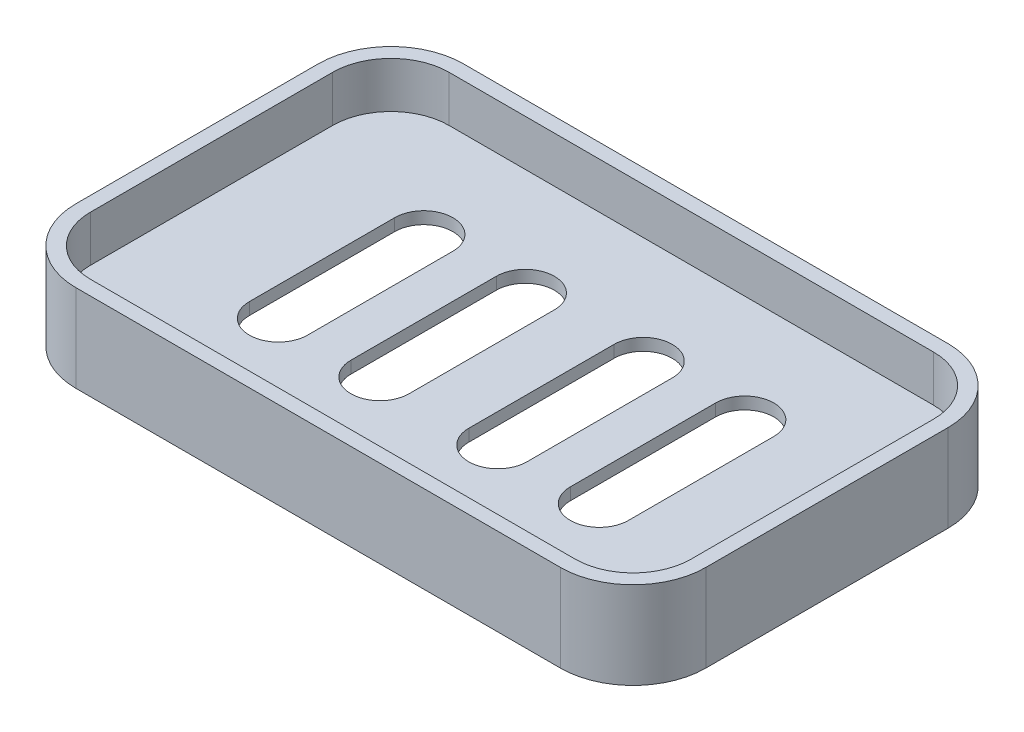
from build123d import *

# Parameters (mm, degrees)
BOSS_EXTRUDE1_DEPTH      = 12
BOSS_EXTRUDE1_DEPTH_BACK = 6
BOSS_EXTRUDE2_DEPTH      = 2.5


with BuildPart() as part:
    # Sketch1 → Boss-Extrude1 (new, two sides: drawn at the far end of the back side and taken through both)
    with BuildSketch(Plane(origin=(0, 0, 0), x_dir=(1, 0, 0), z_dir=(0, 1, 0)).offset(-BOSS_EXTRUDE1_DEPTH_BACK)):
        with BuildLine():
            Line((37.955974843, 34.748427673), (-62.044025157, 34.748427673))
            ThreePointArc((-62.044025157, 34.748427673), (-72.650626875, 30.355029391), (-77.044025157, 19.748427673))
            Line((-77.044025157, 19.748427673), (-77.044025157, -30.251572327))
            ThreePointArc((-77.044025157, -30.251572327), (-72.650626875, -40.858174045), (-62.044025157, -45.251572327))
            Line((-62.044025157, -45.251572327), (37.955974843, -45.251572327))
            ThreePointArc((37.955974843, -45.251572327), (48.562576561, -40.858174045), (52.955974843, -30.251572327))
            Line((52.955974843, -30.251572327), (52.955974843, 19.748427673))
            ThreePointArc((52.955974843, 19.748427673), (48.562576561, 30.355029391), (37.955974843, 34.748427673))
        make_face()
        with BuildLine():
            ThreePointArc((-74.044025157, 19.748427673), (-70.529306531, 28.233709047), (-62.044025157, 31.748427673))
            Line((-62.044025157, 31.748427673), (37.955974843, 31.748427673))
            ThreePointArc((37.955974843, 31.748427673), (46.441256217, 28.233709047), (49.955974843, 19.748427673))
            Line((49.955974843, 19.748427673), (49.955974843, -30.251572327))
            ThreePointArc((49.955974843, -30.251572327), (46.441256217, -38.736853701), (37.955974843, -42.251572327))
            Line((37.955974843, -42.251572327), (-62.044025157, -42.251572327))
            ThreePointArc((-62.044025157, -42.251572327), (-70.529306531, -38.736853701), (-74.044025157, -30.251572327))
            Line((-74.044025157, -30.251572327), (-74.044025157, 19.748427673))
        make_face(mode=Mode.SUBTRACT)
    extrude(amount=BOSS_EXTRUDE1_DEPTH + BOSS_EXTRUDE1_DEPTH_BACK)

    # Sketch1<3> → Boss-Extrude2 (add)
    with BuildSketch(Plane(origin=(0, 0, 0), x_dir=(1, 0, 0), z_dir=(0, 1, 0))):
        with BuildLine():
            Line((37.955974843, 31.748427673), (-62.044025157, 31.748427673))
            ThreePointArc((-62.044025157, 31.748427673), (-70.529306531, 28.233709047), (-74.044025157, 19.748427673))
            Line((-74.044025157, 19.748427673), (-74.044025157, -30.251572327))
            ThreePointArc((-74.044025157, -30.251572327), (-70.529306531, -38.736853701), (-62.044025157, -42.251572327))
            Line((-62.044025157, -42.251572327), (37.955974843, -42.251572327))
            ThreePointArc((37.955974843, -42.251572327), (46.441256217, -38.736853701), (49.955974843, -30.251572327))
            Line((49.955974843, -30.251572327), (49.955974843, 19.748427673))
            ThreePointArc((49.955974843, 19.748427673), (46.441256217, 28.233709047), (37.955974843, 31.748427673))
        make_face()
        with BuildLine():
            ThreePointArc((-51.159476074, 9.66385349), (-45.159476074, 15.66385349), (-39.159476074, 9.66385349))
            Line((-39.159476074, 9.66385349), (-39.159476074, -20.33614651))
            ThreePointArc((-39.159476074, -20.33614651), (-45.159476074, -26.33614651), (-51.159476074, -20.33614651))
            Line((-51.159476074, -20.33614651), (-51.159476074, 9.66385349))
        make_face(mode=Mode.SUBTRACT)
        with BuildLine():
            ThreePointArc((-30.207633374, 9.66385349), (-24.207633374, 15.66385349), (-18.207633374, 9.66385349))
            Line((-18.207633374, 9.66385349), (-18.207633374, -20.33614651))
            ThreePointArc((-18.207633374, -20.33614651), (-24.207633374, -26.33614651), (-30.207633374, -20.33614651))
            Line((-30.207633374, -20.33614651), (-30.207633374, 9.66385349))
        make_face(mode=Mode.SUBTRACT)
        with BuildLine():
            Line((-5.880416941, -20.33614651), (-5.880416941, 9.66385349))
            ThreePointArc((-5.880416941, 9.66385349), (0.119583059, 15.66385349), (6.119583059, 9.66385349))
            Line((6.119583059, 9.66385349), (6.119583059, -20.33614651))
            ThreePointArc((6.119583059, -20.33614651), (0.119583059, -26.33614651), (-5.880416941, -20.33614651))
        make_face(mode=Mode.SUBTRACT)
        with BuildLine():
            Line((15.07142576, -20.33614651), (15.07142576, 9.66385349))
            ThreePointArc((15.07142576, 9.66385349), (21.07142576, 15.66385349), (27.07142576, 9.66385349))
            Line((27.07142576, 9.66385349), (27.07142576, -20.33614651))
            ThreePointArc((27.07142576, -20.33614651), (21.07142576, -26.33614651), (15.07142576, -20.33614651))
        make_face(mode=Mode.SUBTRACT)
    extrude(amount=BOSS_EXTRUDE2_DEPTH)


solid = part.part
